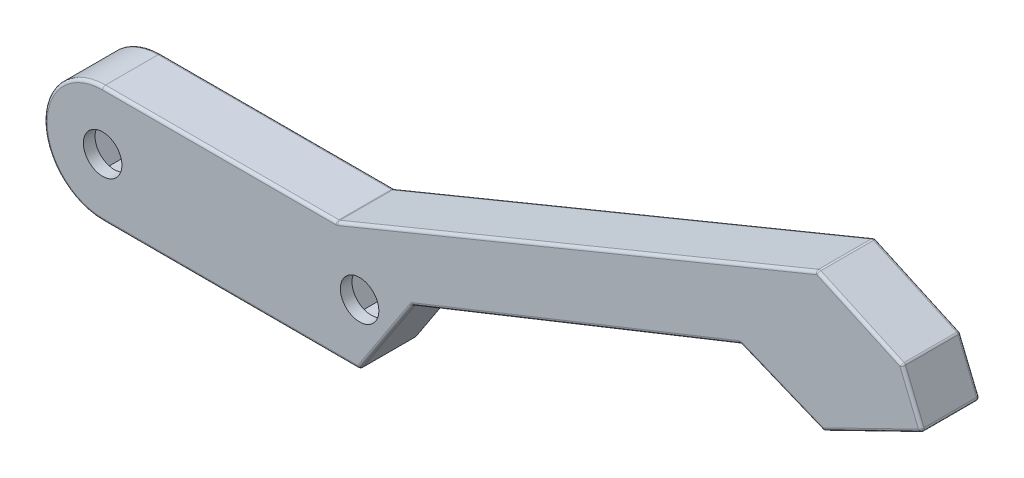
from build123d import *

# Parameters (mm, degrees)
SKETCH1_R           = 1.65
BOSS_EXTRUDE1_DEPTH = 5
FILLET2_R           = 0.25
CUT_EXTRUDE1_DEPTH  = 4


with BuildPart() as part:
    # Sketch1 → Boss-Extrude1 (new body)
    # profile 1 of 2: a face of its own
    with BuildSketch(Plane.XY):
        with BuildLine():
            Line((-5.168635154, -1.464478016), (-25.218635154, -1.464478016))
            ThreePointArc((-25.218635154, -1.464478016), (-30.218635154, -6.464478016), (-25.218635154, -11.464478016))
            Line((-25.218635154, -11.464478016), (-3.218635154, -11.464478016))
            Line((-3.218635154, -11.464478016), (1.36555506, -4.468181425))
            ThreePointArc((1.36555506, -4.468181425), (-0.47833252, -2.282284635), (-3.218635154, -1.464478016))
            Line((-3.218635154, -1.464478016), (-5.168635154, -1.464478016))
        make_face()
        with Locations((-25.218635154, -6.464478016)):
            Circle(SKETCH1_R, mode=Mode.SUBTRACT)
        with Locations((-3.197929879, -6.257635448)):
            Circle(SKETCH1_R, mode=Mode.SUBTRACT)
    # profile 2 of 2: a face of its own
    with BuildSketch(Plane.XY):
        with BuildLine():
            Line((35.988446, 15.45724385), (-5.168635154, -1.464478016))
            Line((-5.168635154, -1.464478016), (-3.218635154, -1.464478016))
            ThreePointArc((-3.218635154, -1.464478016), (-0.47833252, -2.282284635), (1.36555506, -4.468181425))
            Line((1.36555506, -4.468181425), (29.450627286, 6.742809526))
            Line((29.450627286, 6.742809526), (35.767904523, 4.15974363))
            Line((35.767904523, 4.15974363), (36.563833051, 3.839605387))
            Line((36.563833051, 3.839605387), (45.016686804, 7.962377757))
            Line((45.016686804, 7.962377757), (43.305501447, 12.124329784))
            Line((43.305501447, 12.124329784), (35.988446, 15.45724385))
        make_face()
    extrude(amount=BOSS_EXTRUDE1_DEPTH)

    # Fillet2
    fillet2_edges = [part.edges().sort_by_distance(p)[0] for p in [
        (-14.218635154, -11.464478016, 0),
        (-30.218635154, -6.464478016, 0),
        (-15.193635154, -1.464478016, 0),
        (15.409905423, 6.996382917, 0),
        (-0.926540047, -7.966329721, 5),
        (39.646973723, 13.790786817, 0),
        (44.161094126, 10.04335377, 0),
        (40.790259928, 5.900991572, 0),
        (36.165868787, 3.999674508, 0),
        (32.609265904, 5.451276578, 0),
        (15.408091173, 1.137314051, 0),
        (-0.926540047, -7.966329721, 0),
        (15.408091173, 1.137314051, 5),
        (-3.218635154, -11.464478016, 2.5),
        (-5.168635154, -1.464478016, 2.5),
        (35.988446, 15.45724385, 2.5),
        (43.305501447, 12.124329784, 2.5),
        (45.016686804, 7.962377757, 2.5),
        (36.563833051, 3.839605387, 2.5),
        (35.767904523, 4.15974363, 2.5),
        (29.450627286, 6.742809526, 2.5),
        (1.36555506, -4.468181425, 2.5),
        (32.609265904, 5.451276578, 5),
        (36.165868787, 3.999674508, 5),
        (40.790259928, 5.900991572, 5),
        (44.161094126, 10.04335377, 5),
        (39.646973723, 13.790786817, 5),
        (15.409905423, 6.996382917, 5),
        (-15.193635154, -1.464478016, 5),
        (-30.218635154, -6.464478016, 5),
        (-14.218635154, -11.464478016, 5),
    ]]
    fillet(fillet2_edges, radius=FILLET2_R)

    # Sketch2 → Cut-Extrude1 (cut)
    with BuildSketch(Plane.XY):
        Polygon((-23.630921913, -9.214478016), (-22.043208673, -6.464478016), (-23.630921913, -3.714478016), (-26.806348394, -3.714478016), (-28.394061634, -6.464478016), (-26.806348394, -9.214478016), align=None)
        Polygon((-0.027560565, -6.436777135), (-1.45760397, -3.601585926), (-4.627973284, -3.422444239), (-6.368299193, -6.078493761), (-4.938255788, -8.91368497), (-1.767886474, -9.092826657), align=None)
    extrude(amount=CUT_EXTRUDE1_DEPTH, mode=Mode.SUBTRACT)


solid = part.part
